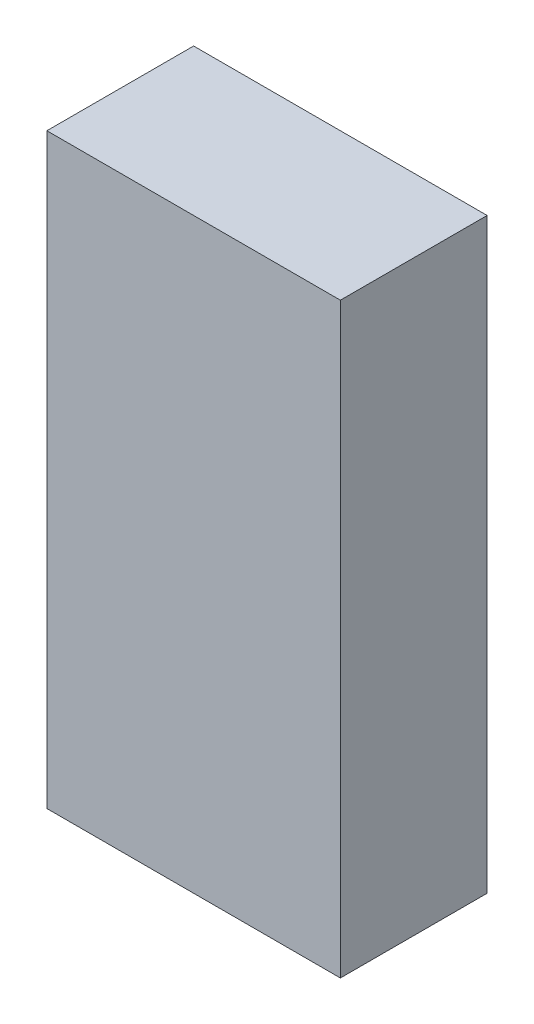
from build123d import *

# Parameters (mm, degrees)
SKETCH1_W           = 10
SKETCH1_H           = 5
BOSS_EXTRUDE1_DEPTH = 20


with BuildPart() as part:
    # Sketch1 → Boss-Extrude1 (new body)
    with BuildSketch(Plane(origin=(0, 0, 0), x_dir=(1, 0, 0), z_dir=(0, 1, 0))):
        with Locations((5, 2.5)):
            Rectangle(SKETCH1_W, SKETCH1_H)
    extrude(amount=BOSS_EXTRUDE1_DEPTH)


solid = part.part
